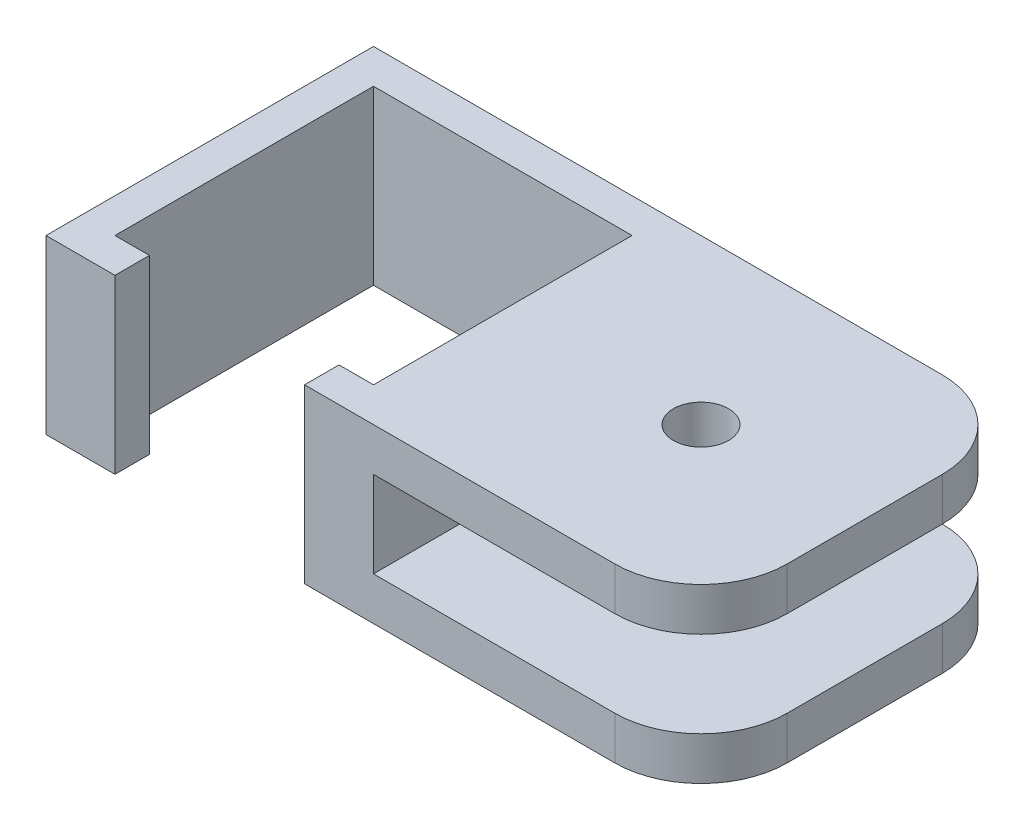
from build123d import *

# Parameters (mm, degrees)
EXTRUDE_3_DEPTH     = 10
SKETCH_5_W          = 19
SKETCH_5_H          = 3
EXTRUDE_5_DEPTH     = 19
SKETCH_6_R          = 1.6
CUT_EXTRUDE_4_DEPTH = 19
SKETCH_7_W          = 19
SKETCH_7_H          = 19
CUT_EXTRUDE_5_DEPTH = 0.5
SKETCH_8_W          = 19
SKETCH_8_H          = 19
CUT_EXTRUDE_7_DEPTH = 0.5


with BuildPart() as part:
    # 草图1 → 凸台-拉伸3 (new body)
    with BuildSketch(Plane(origin=(0, 0, 0), x_dir=(1, 0, 0), z_dir=(0, 1, 0))):
        Polygon((-7.404411765, -8.672794118), (-5.404411765, -8.672794118), (-5.404411765, -10.672794118), (-9.404411765, -10.672794118), (-9.404411765, 8.327205882), (9.595588235, 8.327205882), (9.595588235, -10.672794118), (5.595588235, -10.672794118), (5.595588235, -8.672794118), (7.595588235, -8.672794118), (7.595588235, 6.327205882), (-7.404411765, 6.327205882), align=None)
    extrude(amount=EXTRUDE_3_DEPTH)

    # 草图5 → 凸台-拉伸5 (add)
    with BuildSketch(Plane(origin=(9.595588235, 0, 0), x_dir=(0, 0, -1), z_dir=(1, 0, 0))):
        with Locations((-1.172794118, 8.5)):
            Rectangle(SKETCH_5_W, SKETCH_5_H)
        with Locations((-1.172794118, 1.5)):
            Rectangle(SKETCH_5_W, SKETCH_5_H)
    extrude(amount=EXTRUDE_5_DEPTH)

    # 草图6 → 切除-拉伸4 (cut)
    with BuildSketch(Plane.XZ):
        with Locations(Location((19.095588235, 1.172794118, 0), (0, 0, 270))):
            Circle(SKETCH_6_R)
        with BuildLine():
            Line((23.595588235, 10.672794118), (28.595588235, 10.672794118))
            Line((28.595588235, 10.672794118), (28.595588235, 5.672794118))
            ThreePointArc((28.595588235, 5.672794118), (27.131122141, 9.208328024), (23.595588235, 10.672794118))
        make_face()
        with BuildLine():
            Line((28.595588235, -3.327205882), (28.595588235, -8.327205882))
            Line((28.595588235, -8.327205882), (23.595588235, -8.327205882))
            ThreePointArc((23.595588235, -8.327205882), (27.131122141, -6.862739788), (28.595588235, -3.327205882))
        make_face()
    extrude(amount=-CUT_EXTRUDE_4_DEPTH, mode=Mode.SUBTRACT)

    # 草图7 → 切除-拉伸5 (cut)
    with BuildSketch(Plane.XZ.offset(-7)):
        with Locations((19.095588235, 1.172794118)):
            Rectangle(SKETCH_7_W, SKETCH_7_H)
    extrude(amount=-CUT_EXTRUDE_5_DEPTH, mode=Mode.SUBTRACT)

    # 草图8 → 切除-拉伸7 (cut)
    with BuildSketch(Plane(origin=(0, 3, 0), x_dir=(1, 0, 0), z_dir=(0, 1, 0))):
        with Locations((19.095588235, -1.172794118)):
            Rectangle(SKETCH_8_W, SKETCH_8_H)
    extrude(amount=-CUT_EXTRUDE_7_DEPTH, mode=Mode.SUBTRACT)


solid = part.part
